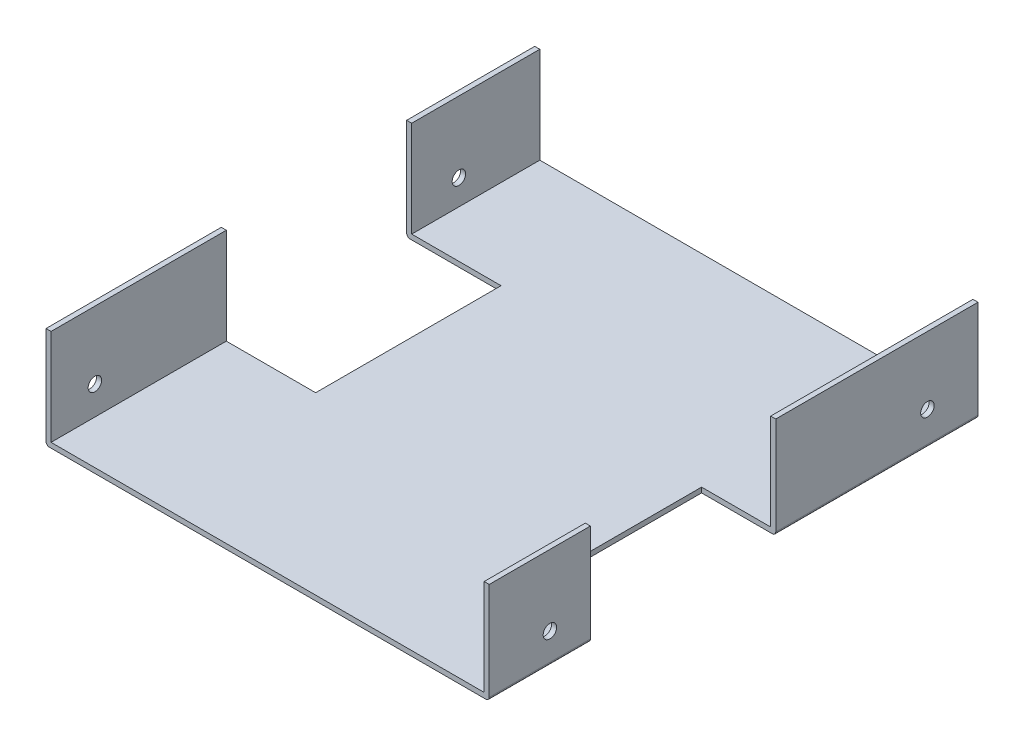
from build123d import *

# Parameters (mm, degrees)
SALIENTE_EXTRUIR1_DEPTH    = 72.5
CORTAR_EXTRUIR1_DEPTH      = 31
CORTAR_EXTRUIR1_DEPTH_BACK = 140
CROQUIS2_W                 = 28
CROQUIS2_H                 = 55
CROQUIS2_W_2               = 22
CORTAR_EXTRUIR2_DEPTH      = 53
CORTAR_EXTRUIR2_DEPTH_BACK = 81
CROQUIS3_R                 = 2
CROQUIS5_R                 = 2
CORTAR_EXTRUIR3_DEPTH      = 81


with BuildPart() as part:
    # Croquis1 → Saliente-Extruir1 (new, symmetric)
    with BuildSketch(Plane.XY):
        with BuildLine():
            Line((-65.75, 14.5), (-64.25, 14.5))
            Line((-64.25, 14.5), (-64.25, -14))
            Line((-64.25, -14), (64.25, -14))
            Line((64.25, -14), (64.25, 14.5))
            Line((64.25, 14.5), (65.75, 14.5))
            Line((65.75, 14.5), (65.75, -14.5))
            ThreePointArc((65.75, -14.5), (65.457106781, -15.207106781), (64.75, -15.5))
            Line((64.75, -15.5), (-64.75, -15.5))
            ThreePointArc((-64.75, -15.5), (-65.457106781, -15.207106781), (-65.75, -14.5))
            Line((-65.75, -14.5), (-65.75, 14.5))
        make_face()
    extrude(amount=SALIENTE_EXTRUIR1_DEPTH, both=True)

    # Croquis2 → Cortar-Extruir1 (cut, two sides: drawn at the far end of the back side and taken through both)
    with BuildSketch(Plane.XZ.offset(15.5).offset(-CORTAR_EXTRUIR1_DEPTH_BACK)):
        with Locations((-51.75, -7)):
            Rectangle(CROQUIS2_W, CROQUIS2_H)
        with Locations((54.75, 15)):
            Rectangle(CROQUIS2_W_2, CROQUIS2_H)
    extrude(amount=CORTAR_EXTRUIR1_DEPTH + CORTAR_EXTRUIR1_DEPTH_BACK, mode=Mode.SUBTRACT)

    # Croquis3 → Cortar-Extruir2 (cut, two sides: drawn at the far end of the back side and taken through both)
    with BuildSketch(Plane.ZY.offset(65.75).offset(-CORTAR_EXTRUIR2_DEPTH_BACK)):
        with Locations(Location((59.5, -5.5, 0), (0, 0, 180))):
            Circle(CROQUIS3_R)
        with Locations(Location((-48.5, -6.5, 0), (0, 0, 180))):
            Circle(CROQUIS3_R)
    extrude(amount=CORTAR_EXTRUIR2_DEPTH + CORTAR_EXTRUIR2_DEPTH_BACK, mode=Mode.SUBTRACT)

    # Croquis5 → Cortar-Extruir3 (cut)
    with BuildSketch(Plane(origin=(65.75, 0, 0), x_dir=(0, 0, -1), z_dir=(1, 0, 0))):
        with Locations(Location((-54.5, -6.5, 0), (0, 0, 90))):
            Circle(CROQUIS5_R)
        with Locations(Location((57.5, -5.5, 0), (0, 0, 90))):
            Circle(CROQUIS5_R)
    extrude(amount=-CORTAR_EXTRUIR3_DEPTH, mode=Mode.SUBTRACT)


solid = part.part
